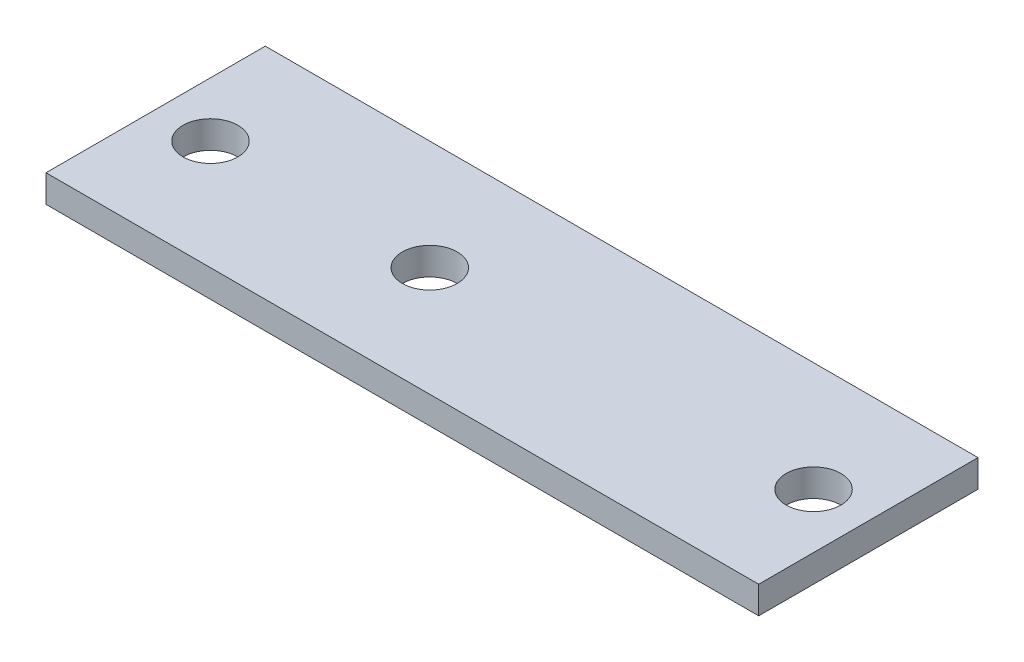
from build123d import *

# Parameters (mm, degrees)
BOSS_EXTRUDE1_DEPTH = 3.175


with BuildPart() as part:
    # Sketch1 → Boss-Extrude1 (new body)
    with BuildSketch(Plane(origin=(0, 0, 0), x_dir=(1, 0, 0), z_dir=(0, 1, 0))):
        Polygon((0, 25.4), (0, 12.7), (0, 0), (82.55, 0), (82.55, 25.4), align=None)
        with BuildLine():
            ThreePointArc((9.525, 12.7), (6.35, 9.525), (3.175, 12.7))
            ThreePointArc((3.175, 12.7), (6.35, 15.875), (9.525, 12.7))
        make_face(mode=Mode.SUBTRACT)
        with BuildLine():
            ThreePointArc((34.925, 12.7), (31.75, 9.525), (28.575, 12.7))
            ThreePointArc((28.575, 12.7), (31.75, 15.875), (34.925, 12.7))
        make_face(mode=Mode.SUBTRACT)
        with BuildLine():
            ThreePointArc((79.375, 12.7), (76.2, 9.525), (73.025, 12.7))
            ThreePointArc((73.025, 12.7), (76.2, 15.875), (79.375, 12.7))
        make_face(mode=Mode.SUBTRACT)
    extrude(amount=BOSS_EXTRUDE1_DEPTH)


solid = part.part
